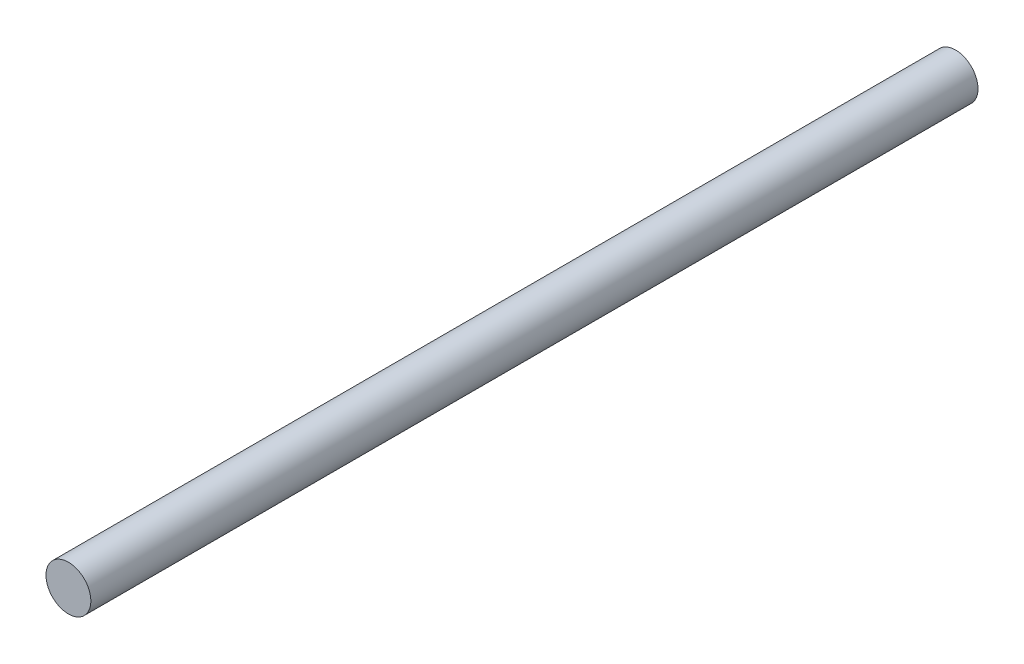
from build123d import *

# Parameters (mm, degrees)
SKETCH1_R           = 1.5875
BOSS_EXTRUDE1_DEPTH = 62.738


with BuildPart() as part:
    # Sketch1 → Boss-Extrude1 (new body)
    with BuildSketch(Plane.XY):
        Circle(SKETCH1_R)
    extrude(amount=BOSS_EXTRUDE1_DEPTH)


solid = part.part
